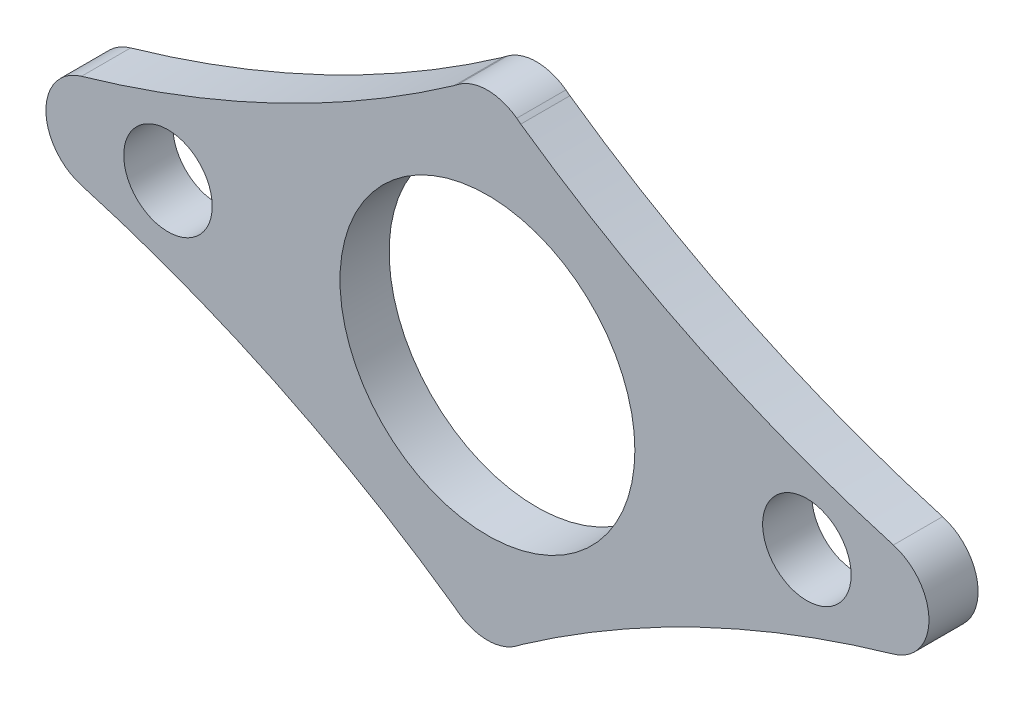
from build123d import *

# Parameters (mm, degrees)
SKETCH1_R           = 30
SKETCH1_R_2         = 9
BOSS_EXTRUDE6_DEPTH = 10
FILLET3_R           = 10


with BuildPart() as part:
    # Sketch1 → Boss-Extrude6 (new body)
    with BuildSketch(Plane.XY):
        with BuildLine():
            ThreePointArc((-6.784902735, 45.870205505), (-48.86656481, 21.950698185), (-94.721398344, 6.447687029))
            ThreePointArc((-94.721398344, 6.447687029), (-107.326810614, 3.090981083), (-120, 0))
            ThreePointArc((-120, 0), (-107.326810614, -3.090981083), (-94.721398344, -6.447687029))
            ThreePointArc((-94.721398344, -6.447687029), (-48.86656481, -21.950698185), (-6.784902735, -45.870205505))
            ThreePointArc((-6.784902735, -45.870205505), (-3.521865451, -48.147719136), (0, -50))
            ThreePointArc((0, -50), (3.521865451, -48.147719136), (6.784902735, -45.870205505))
            ThreePointArc((6.784902735, -45.870205505), (48.86656481, -21.950698185), (94.721398344, -6.447687029))
            ThreePointArc((94.721398344, -6.447687029), (107.326810614, -3.090981083), (120, 0))
            ThreePointArc((120, 0), (107.326810614, 3.090981083), (94.721398344, 6.447687029))
            ThreePointArc((94.721398344, 6.447687029), (48.86656481, 21.950698185), (6.784902735, 45.870205505))
            ThreePointArc((6.784902735, 45.870205505), (3.521865451, 48.147719136), (0, 50))
            ThreePointArc((0, 50), (-3.521865451, 48.147719136), (-6.784902735, 45.870205505))
        make_face()
        Circle(SKETCH1_R, mode=Mode.SUBTRACT)
        with Locations((-65, 0)):
            Circle(SKETCH1_R_2, mode=Mode.SUBTRACT)
        with Locations((65, 0)):
            Circle(SKETCH1_R_2, mode=Mode.SUBTRACT)
    extrude(amount=BOSS_EXTRUDE6_DEPTH)

    # Fillet3
    fillet3_edges = [part.edges().sort_by_distance(p)[0] for p in [
        (0, -50, 5),
        (120, 0, 5),
        (-120, 0, 5),
        (0, 50, 5),
    ]]
    fillet(fillet3_edges, radius=FILLET3_R)


solid = part.part
